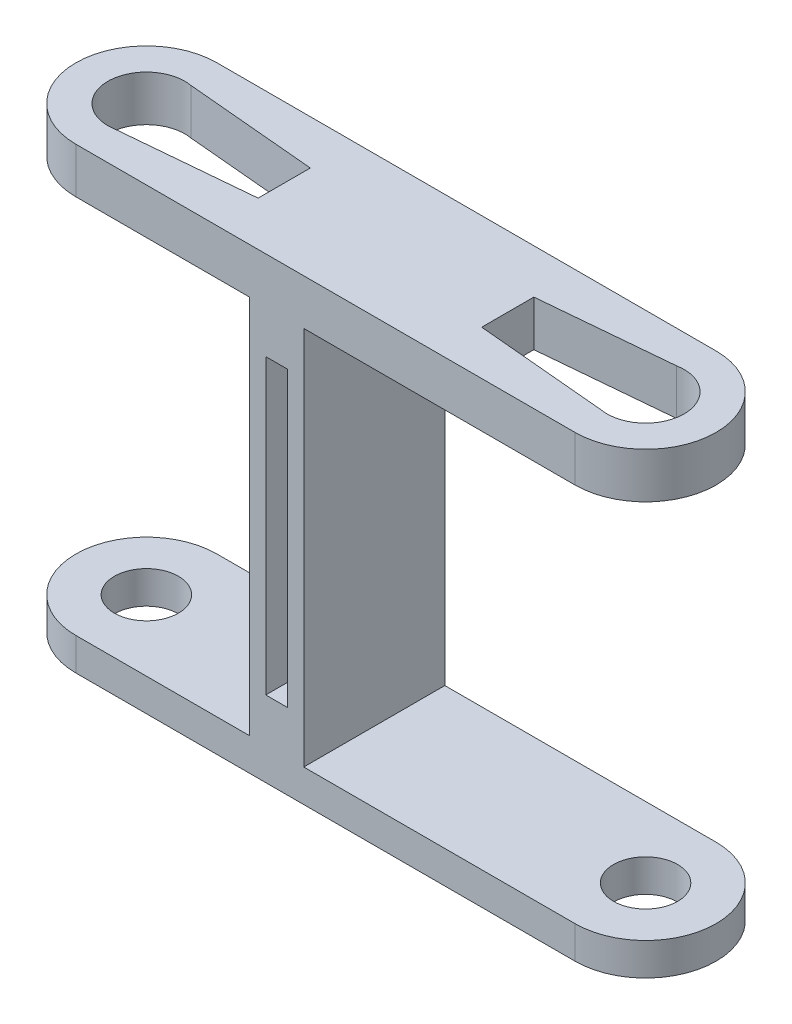
from build123d import *

# Parameters (mm, degrees)
BOSS_EXTRUDE1_START   = 43.6
SKETCH1_R             = 6.5
BOSS_EXTRUDE1_DEPTH   = 2.1
BOSS_EXTRUDE1_2_DEPTH = 2.1
BOSS_EXTRUDE2_START   = 43.6
SKETCH2_W             = 46
SKETCH2_H             = 13
BOSS_EXTRUDE2_DEPTH   = 2.1
CUT_EXTRUDE1_START    = 43.6
SKETCH3_R             = 3.55
CUT_EXTRUDE1_DEPTH    = 2.1
CUT_EXTRUDE2_START    = 43.6
CUT_EXTRUDE2_DEPTH    = 2.1
BOSS_EXTRUDE3_START   = 5
SKETCH5_R             = 6.5
BOSS_EXTRUDE3_DEPTH   = 1.5
BOSS_EXTRUDE3_2_DEPTH = 1.5
BOSS_EXTRUDE4_START   = 5
SKETCH6_W             = 46
SKETCH6_H             = 13
BOSS_EXTRUDE4_DEPTH   = 1.5
CUT_EXTRUDE3_START    = 5
SKETCH7_R             = 2.95
CUT_EXTRUDE3_DEPTH    = 1.5
BOSS_EXTRUDE5_START   = 18.5
SKETCH8_W             = 13
SKETCH8_H             = 42.2
BOSS_EXTRUDE5_DEPTH   = 2.5
CUT_EXTRUDE4_START    = -0.01
SKETCH9_W             = 2
SKETCH9_H             = 27
CUT_EXTRUDE4_DEPTH    = 6.51


with BuildPart() as part:
    # Sketch1 → Boss-Extrude1 (new, symmetric)
    with BuildSketch(Plane(origin=(0, 0, 0), x_dir=(1, 0, 0), z_dir=(0, 1, 0)).offset(BOSS_EXTRUDE1_START)):
        with Locations(Location((0, 0, 0), (0, 0, 270))):
            Circle(SKETCH1_R)
    extrude(amount=BOSS_EXTRUDE1_DEPTH, both=True)



with BuildPart() as body_2:
    # Sketch1 → Boss-Extrude1 2 (new, symmetric)
    with BuildSketch(Plane(origin=(0, 0, 0), x_dir=(1, 0, 0), z_dir=(0, 1, 0)).offset(BOSS_EXTRUDE1_START)):
        with Locations(Location((46, 0, 0), (0, 0, 270))):
            Circle(SKETCH1_R)
    extrude(amount=BOSS_EXTRUDE1_2_DEPTH, both=True)


with BuildPart() as part_1:
    add(part.part)

    add(body_2.part)  # Boss-Extrude2 merges body 2
    # Sketch2 → Boss-Extrude2 (add, symmetric)
    with BuildSketch(Plane(origin=(0, 0, 0), x_dir=(1, 0, 0), z_dir=(0, 1, 0)).offset(BOSS_EXTRUDE2_START)):
        with Locations((23, 0)):
            Rectangle(SKETCH2_W, SKETCH2_H)
    extrude(amount=BOSS_EXTRUDE2_DEPTH, both=True)

    # Sketch3 → Cut-Extrude1 (cut, symmetric)
    with BuildSketch(Plane(origin=(0, 0, 0), x_dir=(1, 0, 0), z_dir=(0, 1, 0)).offset(CUT_EXTRUDE1_START)):
        with Locations(Location((0, 0, 0), (0, 0, 270))):
            Circle(SKETCH3_R)
        with Locations(Location((46, 0, 0), (0, 0, 270))):
            Circle(SKETCH3_R)
    extrude(amount=CUT_EXTRUDE1_DEPTH, both=True, mode=Mode.SUBTRACT)

    # Sketch4 → Cut-Extrude2 (cut, symmetric)
    with BuildSketch(Plane(origin=(0, 0, 0), x_dir=(1, 0, 0), z_dir=(0, 1, 0)).offset(CUT_EXTRUDE2_START)):
        Polygon((0, -3.55), (12.7, -2.403281405), (12.7, 2.403281405), (0, 3.55), align=None)
        Polygon((46, 3.55), (33.3, 2.403281405), (33.3, -2.403281405), (46, -3.55), align=None)
    extrude(amount=CUT_EXTRUDE2_DEPTH, both=True, mode=Mode.SUBTRACT)



with BuildPart() as body_2_2:
    # Sketch5 → Boss-Extrude3 (new, symmetric)
    with BuildSketch(Plane(origin=(0, 0, 0), x_dir=(1, 0, 0), z_dir=(0, 1, 0)).offset(BOSS_EXTRUDE3_START)):
        with Locations(Location((0, 0, 0), (0, 0, 270))):
            Circle(SKETCH5_R)
    extrude(amount=BOSS_EXTRUDE3_DEPTH, both=True)



with BuildPart() as body_3:
    # Sketch5 → Boss-Extrude3 2 (new, symmetric)
    with BuildSketch(Plane(origin=(0, 0, 0), x_dir=(1, 0, 0), z_dir=(0, 1, 0)).offset(BOSS_EXTRUDE3_START)):
        with Locations(Location((46, 0, 0), (0, 0, 270))):
            Circle(SKETCH5_R)
    extrude(amount=BOSS_EXTRUDE3_2_DEPTH, both=True)


with BuildPart() as body_2_2_1:
    add(body_2_2.part)

    add(body_3.part)  # Boss-Extrude4 merges body 3
    # Sketch6 → Boss-Extrude4 (add, symmetric)
    with BuildSketch(Plane(origin=(0, 0, 0), x_dir=(1, 0, 0), z_dir=(0, 1, 0)).offset(BOSS_EXTRUDE4_START)):
        with Locations((23, 0)):
            Rectangle(SKETCH6_W, SKETCH6_H)
    extrude(amount=BOSS_EXTRUDE4_DEPTH, both=True)

    # Sketch7 → Cut-Extrude3 (cut, symmetric)
    with BuildSketch(Plane(origin=(0, 0, 0), x_dir=(1, 0, 0), z_dir=(0, 1, 0)).offset(CUT_EXTRUDE3_START)):
        with Locations(Location((0, 0, 0), (0, 0, 270))):
            Circle(SKETCH7_R)
        with Locations(Location((46, 0, 0), (0, 0, 270))):
            Circle(SKETCH7_R)
    extrude(amount=CUT_EXTRUDE3_DEPTH, both=True, mode=Mode.SUBTRACT)


with BuildPart() as part_2:
    add(part_1.part)

    add(body_2_2_1.part)  # Boss-Extrude5 merges body 2 2
    # Sketch8 → Boss-Extrude5 (add, symmetric)
    with BuildSketch(Plane(origin=(0, 0, 0), x_dir=(0, 0, -1), z_dir=(1, 0, 0)).offset(BOSS_EXTRUDE5_START)):
        with Locations((0, 24.6)):
            Rectangle(SKETCH8_W, SKETCH8_H)
    extrude(amount=BOSS_EXTRUDE5_DEPTH, both=True)

    # Sketch9 → Cut-Extrude4 (cut, symmetric)
    with BuildSketch(Plane.XY.offset(CUT_EXTRUDE4_START)):
        with Locations((18.5, 24)):
            Rectangle(SKETCH9_W, SKETCH9_H)
    extrude(amount=CUT_EXTRUDE4_DEPTH, both=True, mode=Mode.SUBTRACT)


solid = part_2.part
